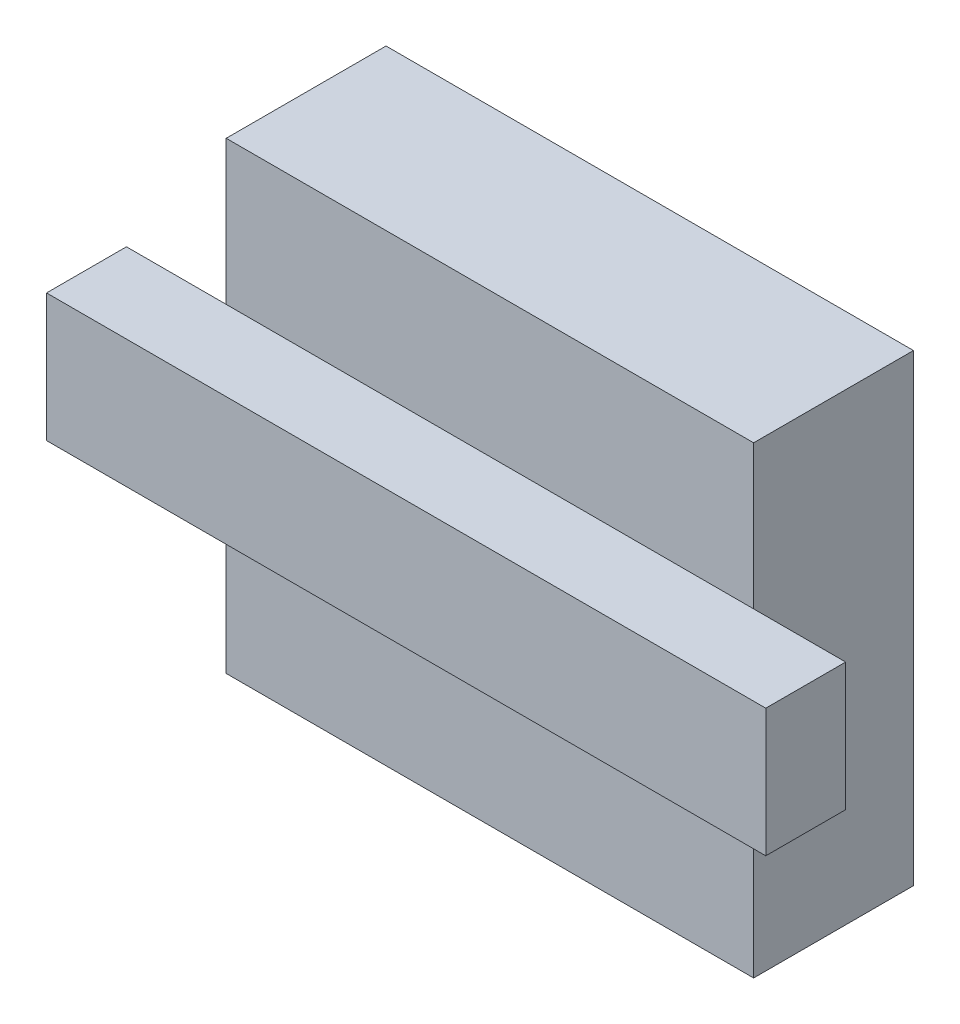
from build123d import *

# Parameters (mm, degrees)
SKETCH3_W           = 33
SKETCH3_H           = 29
BOSS_EXTRUDE1_DEPTH = 10
SKETCH4_W           = 45
SKETCH4_H           = 8
BOSS_EXTRUDE3_DEPTH = 5


with BuildPart() as part:
    # Sketch3 → Boss-Extrude1 (new body)
    with BuildSketch(Plane.XY):
        with Locations((16.5, 14.5)):
            Rectangle(SKETCH3_W, SKETCH3_H)
    extrude(amount=BOSS_EXTRUDE1_DEPTH)

    # Sketch4 → Boss-Extrude3 (add)
    with BuildSketch(Plane.XY.offset(10)):
        with Locations((16.258624128, 16)):
            Rectangle(SKETCH4_W, SKETCH4_H)
    extrude(amount=BOSS_EXTRUDE3_DEPTH)


solid = part.part
